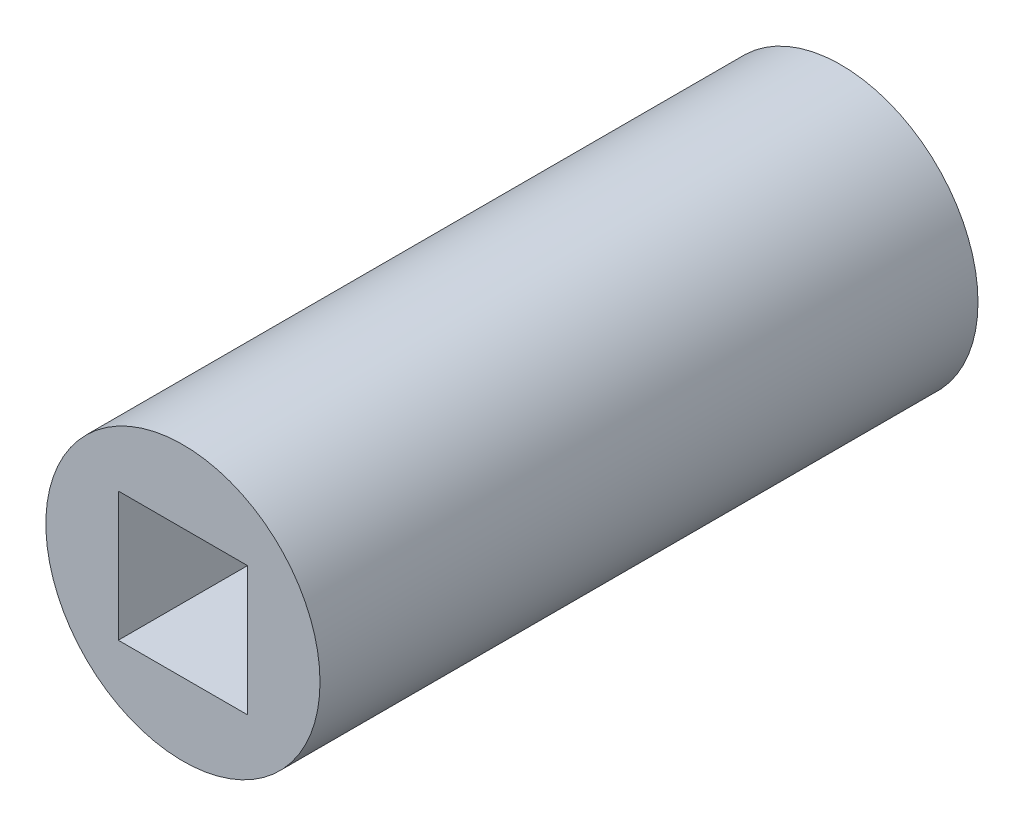
from build123d import *

# Parameters (mm, degrees)
SKETCH1_R           = 3.75
BOSS_EXTRUDE1_DEPTH = 18
SKETCH2_W           = 3.535533906
SKETCH2_H           = 3.535533906
CUT_EXTRUDE1_DEPTH  = 10
SKETCH3_W           = 2.1
SKETCH3_H           = 1.45
SKETCH3_H_2         = 2.1
SKETCH3_W_2         = 1.45
CUT_EXTRUDE2_DEPTH  = 8


with BuildPart() as part:
    # Sketch1 → Boss-Extrude1 (new body)
    with BuildSketch(Plane.XY):
        Circle(SKETCH1_R)
    extrude(amount=BOSS_EXTRUDE1_DEPTH)

    # Sketch2 → Cut-Extrude1 (cut)
    with BuildSketch(Plane.XY.offset(18)):
        Rectangle(SKETCH2_W, SKETCH2_H)
    extrude(amount=-CUT_EXTRUDE1_DEPTH, mode=Mode.SUBTRACT)

    # Sketch3 → Cut-Extrude2 (cut)
    with BuildSketch(Plane(origin=(0, 0, 0), x_dir=(-1, 0, 0), z_dir=(0, 0, -1))):
        with Locations((0, 1.775)):
            Rectangle(SKETCH3_W, SKETCH3_H)
        Rectangle(SKETCH3_W, SKETCH3_H_2)
        with Locations((1.775, 0)):
            Rectangle(SKETCH3_W_2, SKETCH3_H_2)
        with Locations((0, -1.775)):
            Rectangle(SKETCH3_W, SKETCH3_H)
        with Locations((-1.775, 0)):
            Rectangle(SKETCH3_W_2, SKETCH3_H_2)
    extrude(amount=-CUT_EXTRUDE2_DEPTH, mode=Mode.SUBTRACT)


solid = part.part
